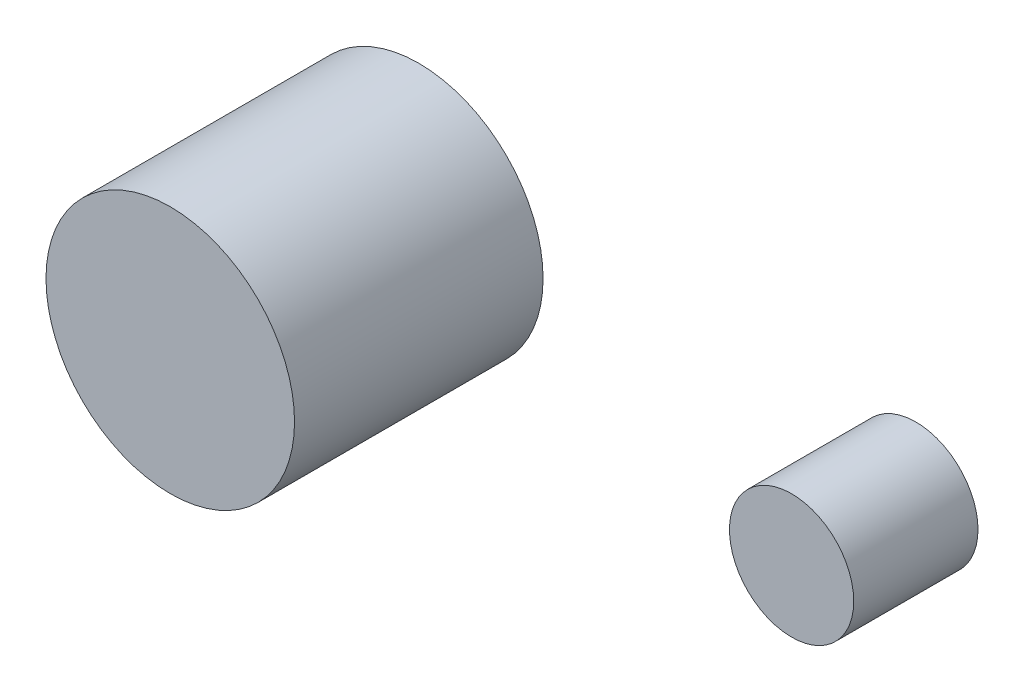
from build123d import *

# Parameters (mm, degrees)
SKETCH_FIRST_R       = 10
FEATURE_FIRST_DEPTH  = 20
SKETCH_SECOND_R      = 5
FEATURE_SECOND_DEPTH = 10


with BuildPart() as part:
    # sketch:first → feature:first (new body)
    with BuildSketch(Plane.XY):
        Circle(SKETCH_FIRST_R)
    extrude(amount=FEATURE_FIRST_DEPTH)


with BuildPart() as body_2:
    # sketch:second → feature:second (new body)
    with BuildSketch(Plane.XY):
        with Locations((40, 0)):
            Circle(SKETCH_SECOND_R)
    extrude(amount=FEATURE_SECOND_DEPTH)


solid = Compound([part.part, body_2.part])
